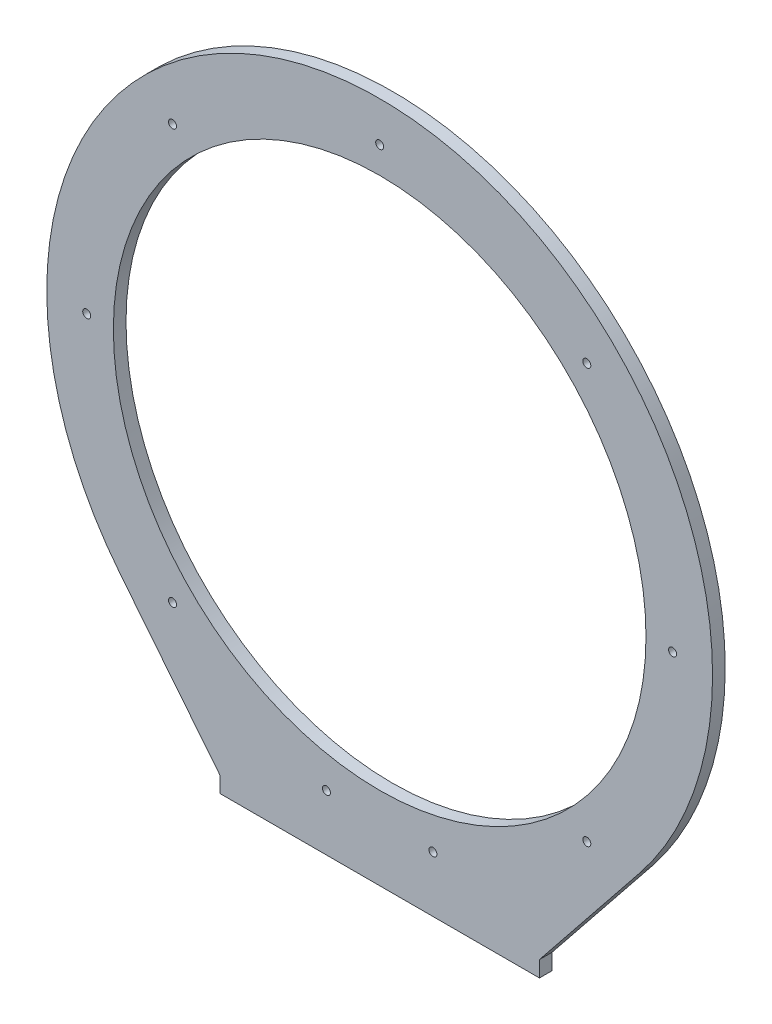
from build123d import *

# Parameters (mm, degrees)
SKETCH1_R           = 1.5
SKETCH1_R_2         = 100
BOSS_EXTRUDE1_DEPTH = 4.75


with BuildPart() as part:
    # Sketch1 → Boss-Extrude1 (new body)
    with BuildSketch(Plane.XY):
        with BuildLine():
            Line((-97.529258777, -78.185955788), (-60, -125.000000002))
            Line((-60, -125.000000002), (-60, -131.000000002))
            Line((-60, -131.000000002), (60, -131.000000002))
            Line((60, -131.000000002), (60, -125.000000002))
            Line((60, -125.000000002), (97.529258777, -78.185955788))
            ThreePointArc((97.529258777, -78.185955788), (0, 125), (-97.529258777, -78.185955788))
        make_face()
        with Locations((-77.781745931, -77.781745931)):
            Circle(SKETCH1_R, mode=Mode.SUBTRACT)
        with Locations((-20, -110)):
            Circle(SKETCH1_R, mode=Mode.SUBTRACT)
        with Locations((20, -110)):
            Circle(SKETCH1_R, mode=Mode.SUBTRACT)
        with Locations((77.781745931, -77.781745931)):
            Circle(SKETCH1_R, mode=Mode.SUBTRACT)
        with Locations((-110, 0)):
            Circle(SKETCH1_R, mode=Mode.SUBTRACT)
        with Locations((-77.781745931, 77.781745931)):
            Circle(SKETCH1_R, mode=Mode.SUBTRACT)
        Circle(SKETCH1_R_2, mode=Mode.SUBTRACT)
        with Locations((110, 0)):
            Circle(SKETCH1_R, mode=Mode.SUBTRACT)
        with Locations((0, 110)):
            Circle(SKETCH1_R, mode=Mode.SUBTRACT)
        with Locations((77.781745931, 77.781745931)):
            Circle(SKETCH1_R, mode=Mode.SUBTRACT)
    extrude(amount=BOSS_EXTRUDE1_DEPTH)


solid = part.part
